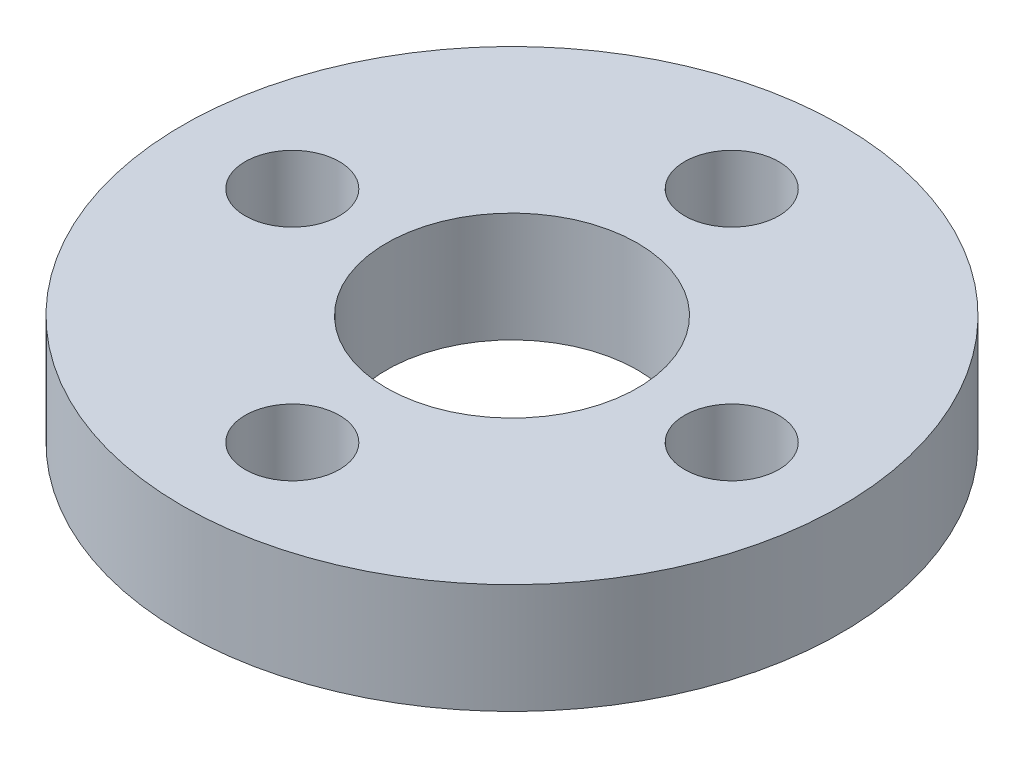
from build123d import *

# Parameters (mm, degrees)
SKETCH1_R           = 10.5
BOSS_EXTRUDE1_DEPTH = 3.5
SKETCH2_R           = 4
SKETCH2_R_2         = 1.5
CUT_EXTRUDE1_DEPTH  = 10.2


with BuildPart() as part:
    # Sketch1 → Boss-Extrude1 (new body)
    with BuildSketch(Plane(origin=(0, 0, 0), x_dir=(1, 0, 0), z_dir=(0, 1, 0))):
        with Locations(Location((0, 0, 0), (0, 0, 90))):
            Circle(SKETCH1_R)
    extrude(amount=BOSS_EXTRUDE1_DEPTH)

    # Sketch2 → Cut-Extrude1 (cut)
    with BuildSketch(Plane(origin=(0, 3.5, 0), x_dir=(1, 0, 0), z_dir=(0, 1, 0))):
        with Locations(Location((0, 0, 0), (0, 0, 270))):
            Circle(SKETCH2_R)
        with Locations(Location((0, 7, 0), (0, 0, 270))):
            Circle(SKETCH2_R_2)
        with Locations(Location((7, 0, 0), (0, 0, 270))):
            Circle(SKETCH2_R_2)
        with Locations(Location((0, -7, 0), (0, 0, 270))):
            Circle(SKETCH2_R_2)
        with Locations(Location((-7, 0, 0), (0, 0, 270))):
            Circle(SKETCH2_R_2)
    extrude(amount=-CUT_EXTRUDE1_DEPTH, mode=Mode.SUBTRACT)


solid = part.part
